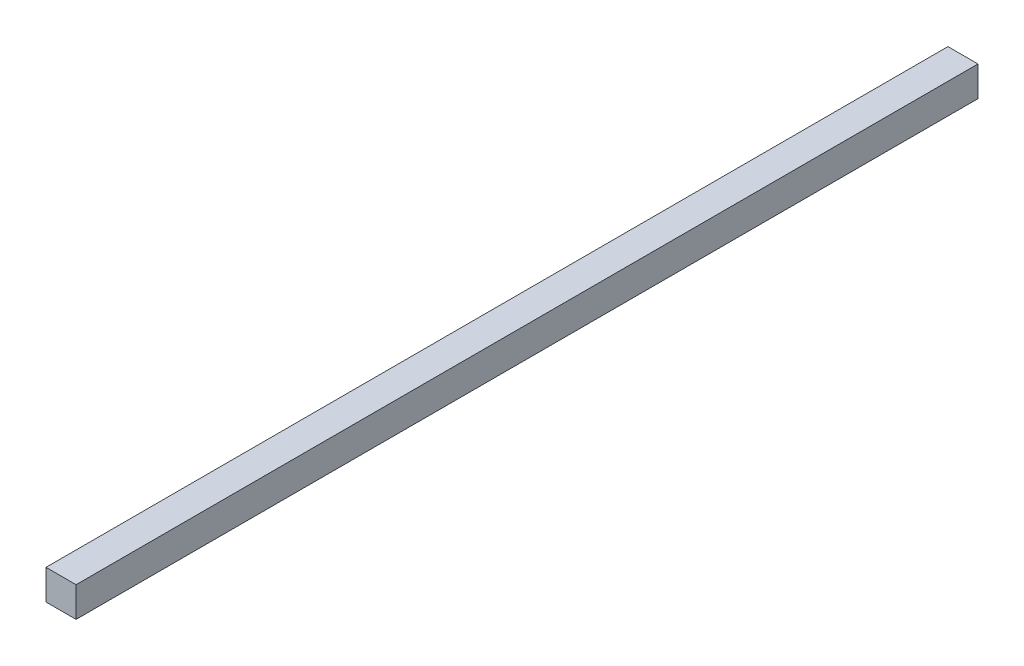
from build123d import *

# Parameters (mm, degrees)
ESQUISSE1_W        = 200
ESQUISSE1_H        = 200
BOSS_EXTRU_1_DEPTH = 6000


with BuildPart() as part:
    # Esquisse1 → Boss.-Extru.1 (new body)
    with BuildSketch(Plane.XY):
        with Locations((-100, 100)):
            Rectangle(ESQUISSE1_W, ESQUISSE1_H)
    extrude(amount=-BOSS_EXTRU_1_DEPTH)


solid = part.part
